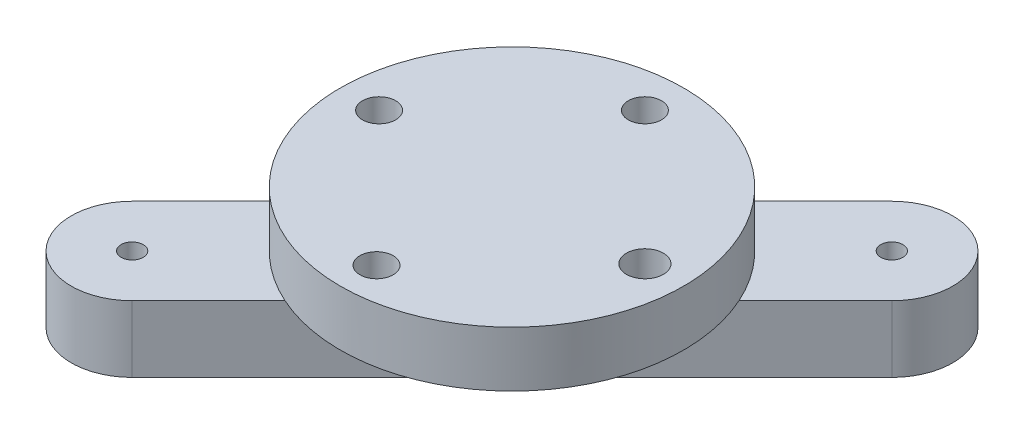
from build123d import *

# Parameters (mm, degrees)
SKETCH1_R           = 31
BOSS_EXTRUDE1_DEPTH = 10
SKETCH3_R           = 5
CUT_EXTRUDE1_DEPTH  = 4
SKETCH5_R           = 5
CUT_EXTRUDE2_DEPTH  = 4
SKETCH6_R           = 3
SKETCH6_R_2         = 3.329647993
CUT_EXTRUDE3_DEPTH  = 10
SKETCH10_R          = 2
BOSS_EXTRUDE5_DEPTH = 12


with BuildPart() as part:
    # Sketch1 → Boss-Extrude1 (new body)
    with BuildSketch(Plane(origin=(0, 0, 0), x_dir=(1, 0, 0), z_dir=(0, 1, 0))):
        with Locations(Location((0, 0, 0), (0, 0, 270))):
            Circle(SKETCH1_R)
    extrude(amount=BOSS_EXTRUDE1_DEPTH)

    # Sketch3 → Cut-Extrude1 (cut)
    with BuildSketch(Plane(origin=(0, 0, 0), x_dir=(1, 0, 0), z_dir=(0, 1, 0))):
        with Locations(Location((0, 24, 0), (0, 0, 270))):
            Circle(SKETCH3_R)
    extrude(amount=CUT_EXTRUDE1_DEPTH, mode=Mode.SUBTRACT)

    # Sketch5 → Cut-Extrude2 (cut)
    with BuildSketch(Plane(origin=(0, 0, 0), x_dir=(1, 0, 0), z_dir=(0, 1, 0))):
        with Locations(Location((-24, 0, 0), (0, 0, 270))):
            Circle(SKETCH5_R)
        with Locations(Location((24, 0, 0), (0, 0, 270))):
            Circle(SKETCH5_R)
        with Locations(Location((0, -24, 0), (0, 0, 270))):
            Circle(SKETCH5_R)
    extrude(amount=CUT_EXTRUDE2_DEPTH, mode=Mode.SUBTRACT)

    # Sketch6 → Cut-Extrude3 (cut)
    with BuildSketch(Plane(origin=(0, 0, 0), x_dir=(1, 0, 0), z_dir=(0, 1, 0))):
        with Locations(Location((0, -24.460265292, 0), (0, 0, 270))):
            Circle(SKETCH6_R)
        with Locations(Location((-24, 0, 0), (0, 0, 270))):
            Circle(SKETCH6_R)
        with Locations(Location((24, 0, 0), (0, 0, 270))):
            Circle(SKETCH6_R_2)
        with Locations(Location((0, 24, 0), (0, 0, 270))):
            Circle(SKETCH6_R)
    extrude(amount=CUT_EXTRUDE3_DEPTH, mode=Mode.SUBTRACT)

    # Sketch10 → Boss-Extrude5 (add)
    with BuildSketch(Plane(origin=(0, 0, 0), x_dir=(1, 0, 0), z_dir=(0, 1, 0))):
        with BuildLine():
            Line((-42.072853481, -26.516504294), (26.516504294, 42.072853481))
            ThreePointArc((26.516504294, 42.072853481), (42.072853481, 42.072853481), (42.072853481, 26.516504294))
            Line((42.072853481, 26.516504294), (-26.516504294, -42.072853481))
            ThreePointArc((-26.516504294, -42.072853481), (-42.072853481, -42.072853481), (-42.072853481, -26.516504294))
        make_face()
        with Locations(Location((34.294678888, 34.294678888, 0), (0, 0, 270))):
            Circle(SKETCH10_R, mode=Mode.SUBTRACT)
        with Locations(Location((-34.294678888, -34.294678888, 0), (0, 0, 270))):
            Circle(SKETCH10_R, mode=Mode.SUBTRACT)
    extrude(amount=-BOSS_EXTRUDE5_DEPTH)


solid = part.part
